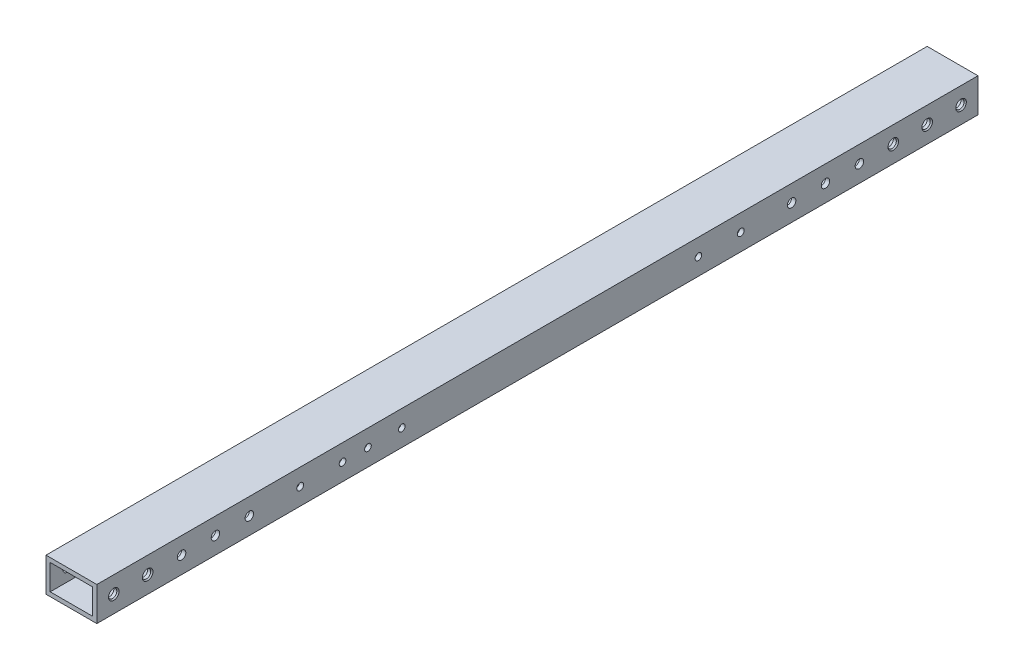
from build123d import *

# Parameters (mm, degrees)
BOSS_EXTRUDE1_DEPTH                  = 330.200001
BOSS_EXTRUDE1_DEPTH_BACK             = 330.200001
SKETCH3_W                            = 38.1
SKETCH3_H                            = 25.4
SKETCH3_W_2                          = 31.75
SKETCH3_H_2                          = 19.05
F_1_4_0_25_DIAMETER_HOLE2_AT_2_COUNT = 2
F_1_4_0_25_DIAMETER_HOLE2_AT_2_PITCH = 25.4
F_1_4_0_25_DIAMETER_HOLE2_AT_3_COUNT = 2
F_1_4_0_25_DIAMETER_HOLE2_AT_3_PITCH = 635.000000508
F_1_4_0_25_DIAMETER_HOLE2_AT_4_COUNT = 2
F_1_4_0_25_DIAMETER_HOLE2_AT_4_PITCH = 50.8
F_1_4_0_25_DIAMETER_HOLE2_AT_5_COUNT = 2
F_1_4_0_25_DIAMETER_HOLE2_AT_5_PITCH = 609.600000508
F_1_4_0_25_DIAMETER_HOLE3_D          = 6.35
F_13_64_0_20313_DIAMETER_HOLE1_D     = 5.159502
F_10_CLEARANCE_HOLE1_D               = 4.9784


with BuildPart() as part:
    # Sketch3 → Boss-Extrude1 (new, two sides: drawn at the far end of the back side and taken through both)
    with BuildSketch(Plane.XY.offset(-BOSS_EXTRUDE1_DEPTH_BACK)):
        Rectangle(SKETCH3_W, SKETCH3_H)
        Rectangle(SKETCH3_W_2, SKETCH3_H_2, mode=Mode.SUBTRACT)
    extrude(amount=BOSS_EXTRUDE1_DEPTH + BOSS_EXTRUDE1_DEPTH_BACK)

    # Sketch8 → 1/4 (0.25) Diameter Hole2 (revolve, cut)
    with BuildSketch(Plane(origin=(-19.05, 0, -317.500000508), x_dir=(0, 0, 1), z_dir=(0, 1, 0))):
        Polygon((0, 0), (0, 38.1), (3.9624, 38.1), (3.175, 37.194199916), (3.175, 0), align=None)
    f_1_4_0_25_diameter_hole2 = revolve(axis=Axis((-25.4, 0, -317.500000508), (1, 0, 0)), mode=Mode.SUBTRACT)

    # 1/4 (0.25) Diameter Hole2 at 2: 1/4 (0.25) Diameter Hole2 ×2
    with Locations(*[(0, 0, i * F_1_4_0_25_DIAMETER_HOLE2_AT_2_PITCH) for i in range(1, F_1_4_0_25_DIAMETER_HOLE2_AT_2_COUNT)]):
        add(f_1_4_0_25_diameter_hole2, mode=Mode.SUBTRACT)

    # 1/4 (0.25) Diameter Hole2 at 3: 1/4 (0.25) Diameter Hole2 ×2
    with Locations(*[(0, 0, i * F_1_4_0_25_DIAMETER_HOLE2_AT_3_PITCH) for i in range(1, F_1_4_0_25_DIAMETER_HOLE2_AT_3_COUNT)]):
        add(f_1_4_0_25_diameter_hole2, mode=Mode.SUBTRACT)

    # 1/4 (0.25) Diameter Hole2 at 4: 1/4 (0.25) Diameter Hole2 ×2
    with Locations(*[(0, 0, i * F_1_4_0_25_DIAMETER_HOLE2_AT_4_PITCH) for i in range(1, F_1_4_0_25_DIAMETER_HOLE2_AT_4_COUNT)]):
        add(f_1_4_0_25_diameter_hole2, mode=Mode.SUBTRACT)

    # 1/4 (0.25) Diameter Hole2 at 5: 1/4 (0.25) Diameter Hole2 ×2
    with Locations(*[(0, 0, i * F_1_4_0_25_DIAMETER_HOLE2_AT_5_PITCH) for i in range(1, F_1_4_0_25_DIAMETER_HOLE2_AT_5_COUNT)]):
        add(f_1_4_0_25_diameter_hole2, mode=Mode.SUBTRACT)

    # 1/4 (0.25) Diameter Hole3 (through all)
    with Locations(Plane(origin=(19.05, 0, 0), x_dir=(0, 0, -1), z_dir=(1, 0, 0))):
        with Locations((-266.7, 0), (-241.3, 0), (-215.9, 0), (241.300000508, 0), (215.900000508, 0), (190.500000508, 0)):
            Hole(F_1_4_0_25_DIAMETER_HOLE3_D / 2)

    # 13/64 (0.20313) Diameter Hole1 (through all)
    with Locations(Plane(origin=(19.05, 0, 0), x_dir=(0, 0, -1), z_dir=(1, 0, 0))):
        with Locations((152.4, 0), (-177.8, 0)):
            Hole(F_13_64_0_20313_DIAMETER_HOLE1_D / 2)

    # #10 Clearance Hole1 (through all)
    with Locations(Plane.ZY.offset(19.05)):
        with Locations((-120.650000508, 0), (146.05, 0), (127.000001483, -2.75e-07), (101.600001483, -1.98e-07)):
            Hole(F_10_CLEARANCE_HOLE1_D / 2)


solid = part.part
